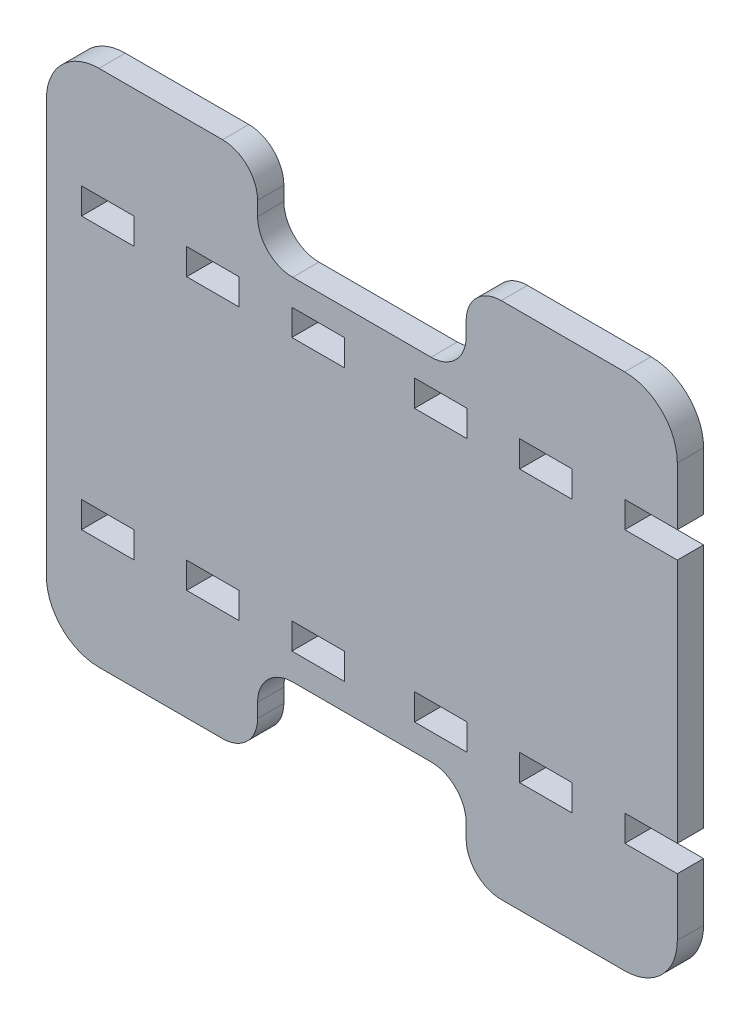
from build123d import *

# Parameters (mm, degrees)
SKETCH1_W           = 30
SKETCH1_H           = 14.936006603
SKETCH1_H_2         = 15
BOSS_EXTRUDE1_DEPTH = 15


with BuildPart() as part:
    # Sketch1 → Boss-Extrude1 (new body)
    with BuildSketch(Plane.XY):
        with BuildLine():
            Line((169.965634662, 155), (169.965634662, 188))
            ThreePointArc((169.965634662, 188), (161.178838098, 209.213203436), (139.965634662, 218))
            Line((139.965634662, 218), (69.465634662, 218))
            ThreePointArc((69.465634662, 218), (55.323499038, 212.142135624), (49.465634662, 198))
            Line((49.465634662, 198), (49.465634662, 190))
            ThreePointArc((49.465634662, 190), (43.607770286, 175.857864376), (29.465634662, 170))
            Line((29.465634662, 170), (-49.534365338, 170))
            ThreePointArc((-49.534365338, 170), (-63.676500962, 175.857864376), (-69.534365338, 190))
            Line((-69.534365338, 190), (-69.534365338, 198))
            ThreePointArc((-69.534365338, 198), (-75.392229714, 212.142135624), (-89.534365338, 218))
            Line((-89.534365338, 218), (-160.034365338, 218))
            ThreePointArc((-160.034365338, 218), (-181.247568774, 209.213203436), (-190.034365338, 188))
            Line((-190.034365338, 188), (-190.034365338, -48))
            ThreePointArc((-190.034365338, -48), (-181.247568774, -69.213203436), (-160.034365338, -78))
            Line((-160.034365338, -78), (-89.534365338, -78))
            ThreePointArc((-89.534365338, -78), (-75.392229714, -72.142135624), (-69.534365338, -58))
            Line((-69.534365338, -58), (-69.534365338, -50))
            ThreePointArc((-69.534365338, -50), (-63.676500962, -35.857864376), (-49.534365338, -30))
            Line((-49.534365338, -30), (29.465634662, -30))
            ThreePointArc((29.465634662, -30), (43.607770286, -35.857864376), (49.465634662, -50))
            Line((49.465634662, -50), (49.465634662, -58))
            ThreePointArc((49.465634662, -58), (55.323499038, -72.142135624), (69.465634662, -78))
            Line((69.465634662, -78), (139.965634662, -78))
            ThreePointArc((139.965634662, -78), (161.178838098, -69.213203436), (169.965634662, -48))
            Line((169.965634662, -48), (169.965634662, -15))
            Line((169.965634662, -15), (140, -15))
            Line((140, -15), (140, 0))
            Line((140, 0), (169.965634662, 0))
            Line((169.965634662, 0), (169.965634662, 140))
            Line((169.965634662, 140), (140, 140))
            Line((140, 140), (140, 155))
            Line((140, 155), (169.965634662, 155))
        make_face()
        with Locations((-155, -7.497163522)):
            Rectangle(SKETCH1_W, SKETCH1_H, mode=Mode.SUBTRACT)
        with Locations((-95, -7.497163522)):
            Rectangle(SKETCH1_W, SKETCH1_H, mode=Mode.SUBTRACT)
        with Locations((-35, -7.497163522)):
            Rectangle(SKETCH1_W, SKETCH1_H, mode=Mode.SUBTRACT)
        with Locations((35, -7.5)):
            Rectangle(SKETCH1_W, SKETCH1_H_2, mode=Mode.SUBTRACT)
        with Locations((95, -7.5)):
            Rectangle(SKETCH1_W, SKETCH1_H_2, mode=Mode.SUBTRACT)
        with Locations((-155, 147.497163521)):
            Rectangle(SKETCH1_W, SKETCH1_H, mode=Mode.SUBTRACT)
        with Locations((-95, 147.497163521)):
            Rectangle(SKETCH1_W, SKETCH1_H, mode=Mode.SUBTRACT)
        with Locations((-35, 147.497163521)):
            Rectangle(SKETCH1_W, SKETCH1_H, mode=Mode.SUBTRACT)
        with Locations((35, 147.5)):
            Rectangle(SKETCH1_W, SKETCH1_H_2, mode=Mode.SUBTRACT)
        with Locations((95, 147.5)):
            Rectangle(SKETCH1_W, SKETCH1_H_2, mode=Mode.SUBTRACT)
    extrude(amount=BOSS_EXTRUDE1_DEPTH)


solid = part.part
